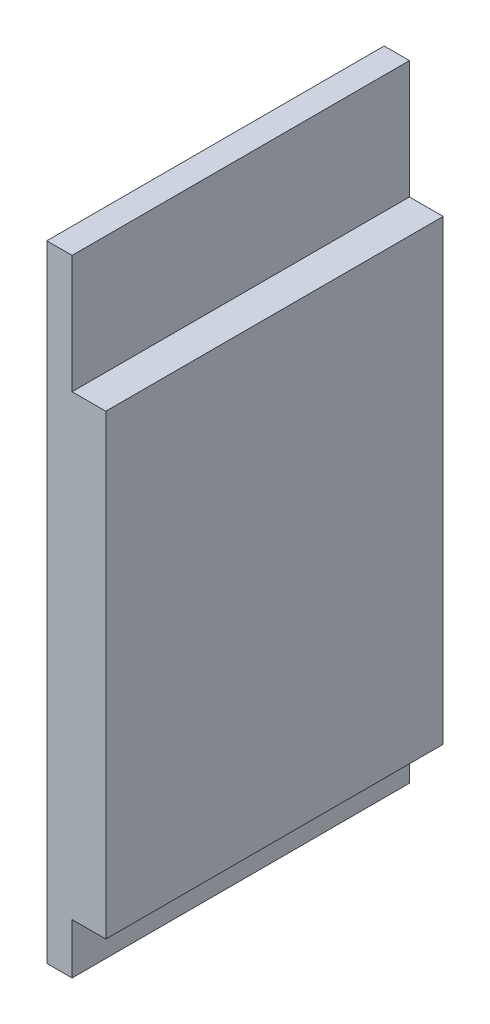
from build123d import *

# Parameters (mm, degrees)
BOSS_EXTRUDE1_DEPTH = 20


with BuildPart() as part:
    # Sketch1 → Boss-Extrude1 (new body)
    with BuildSketch(Plane.XY):
        Polygon((1.75, 18.55), (0.25, 18.55), (0.25, -18.55), (1.75, -18.55), (1.75, -15.55), (3.75, -15.55), (3.75, 11.55), (1.75, 11.55), align=None)
    extrude(amount=BOSS_EXTRUDE1_DEPTH)


solid = part.part
